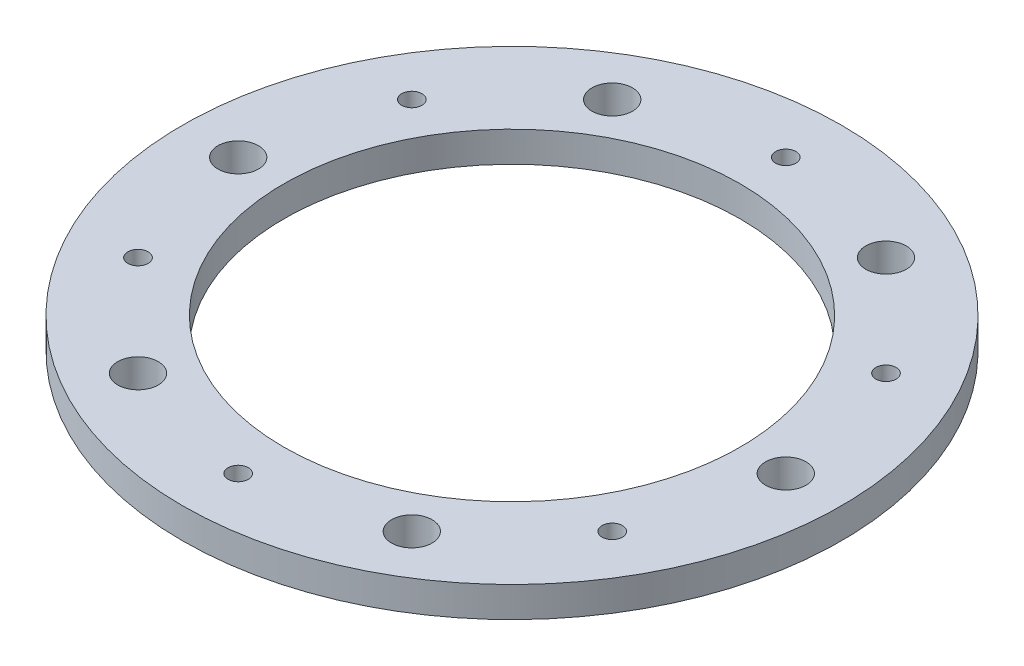
from build123d import *

# Parameters (mm, degrees)
SKETCH1_R           = 32.5
SKETCH1_R_2         = 1
BOSS_EXTRUDE1_DEPTH = 3
SKETCH2_R           = 22.5
SKETCH2_R_2         = 2
CUT_EXTRUDE1_DEPTH  = 47.059743812


with BuildPart() as part:
    # Sketch1 → Boss-Extrude1 (new body)
    with BuildSketch(Plane(origin=(0, 0, 0), x_dir=(1, 0, 0), z_dir=(0, 1, 0))):
        with Locations(Location((0, 0, 0), (0, 0, 270))):
            Circle(SKETCH1_R)
        with Locations(Location((0, 27, 0), (0, 0, 270))):
            Circle(SKETCH1_R_2, mode=Mode.SUBTRACT)
        with Locations(Location((23.382685902, 13.5, 0), (0, 0, 270))):
            Circle(SKETCH1_R_2, mode=Mode.SUBTRACT)
        with Locations(Location((23.382685902, -13.5, 0), (0, 0, 270))):
            Circle(SKETCH1_R_2, mode=Mode.SUBTRACT)
        with Locations(Location((0, -27, 0), (0, 0, 270))):
            Circle(SKETCH1_R_2, mode=Mode.SUBTRACT)
        with Locations(Location((-23.382685902, -13.5, 0), (0, 0, 270))):
            Circle(SKETCH1_R_2, mode=Mode.SUBTRACT)
        with Locations(Location((-23.382685902, 13.5, 0), (0, 0, 270))):
            Circle(SKETCH1_R_2, mode=Mode.SUBTRACT)
    extrude(amount=BOSS_EXTRUDE1_DEPTH)

    # Sketch2 → Cut-Extrude1 (cut, through all)
    with BuildSketch(Plane(origin=(0, 3, 0), x_dir=(1, 0, 0), z_dir=(0, 1, 0))):
        with Locations(Location((0, 0, 0), (0, 0, 270))):
            Circle(SKETCH2_R)
        with Locations(Location((-13.5, 23.382685902, 0), (0, 0, 270))):
            Circle(SKETCH2_R_2)
        with Locations(Location((13.5, 23.382685902, 0), (0, 0, 270))):
            Circle(SKETCH2_R_2)
        with Locations(Location((27, 0, 0), (0, 0, 270))):
            Circle(SKETCH2_R_2)
        with Locations(Location((13.5, -23.382685902, 0), (0, 0, 270))):
            Circle(SKETCH2_R_2)
        with Locations(Location((-13.5, -23.382685902, 0), (0, 0, 270))):
            Circle(SKETCH2_R_2)
        with Locations(Location((-27, 0, 0), (0, 0, 270))):
            Circle(SKETCH2_R_2)
    extrude(amount=-CUT_EXTRUDE1_DEPTH, mode=Mode.SUBTRACT)


solid = part.part
